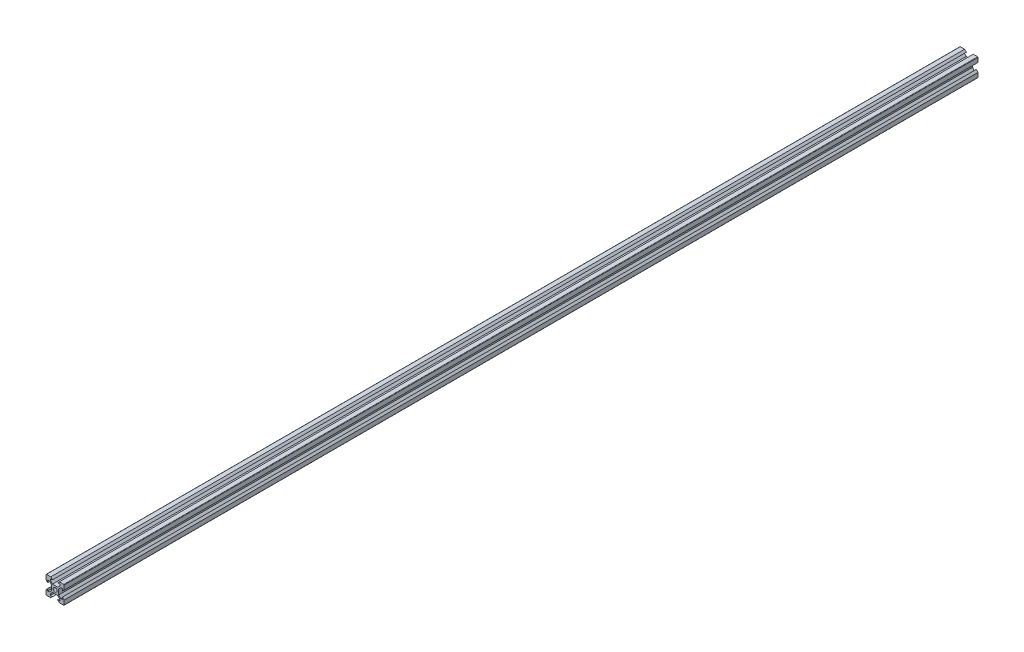
from build123d import *

# Parameters (mm, degrees)
SKETCH1_R           = 2.125
BOSS_EXTRUDE1_DEPTH = 1007.5


with BuildPart() as part:
    # Sketch1 → Boss-Extrude1 (new body)
    with BuildSketch(Plane.XY):
        with BuildLine():
            Line((8.1, 5.225), (8.1, 2.85))
            Line((8.1, 2.85), (10, 4.75))
            Line((10, 4.75), (10, 9.5))
            ThreePointArc((10, 9.5), (9.853553391, 9.853553391), (9.5, 10))
            Line((9.5, 10), (4.75, 10))
            Line((4.75, 10), (2.85, 8.1))
            Line((2.85, 8.1), (5.225, 8.1))
            Line((5.225, 8.1), (5.225, 6.325))
            Line((5.225, 6.325), (2.9, 4))
            Line((2.9, 4), (-2.9, 4))
            Line((-2.9, 4), (-5.225, 6.325))
            Line((-5.225, 6.325), (-5.225, 8.1))
            Line((-5.225, 8.1), (-2.85, 8.1))
            Line((-2.85, 8.1), (-4.75, 10))
            Line((-4.75, 10), (-9.5, 10))
            ThreePointArc((-9.5, 10), (-9.853553391, 9.853553391), (-10, 9.5))
            Line((-10, 9.5), (-10, 4.75))
            Line((-10, 4.75), (-8.1, 2.85))
            Line((-8.1, 2.85), (-8.1, 5.225))
            Line((-8.1, 5.225), (-6.325, 5.225))
            Line((-6.325, 5.225), (-4, 2.9))
            Line((-4, 2.9), (-4, -2.9))
            Line((-4, -2.9), (-6.325, -5.225))
            Line((-6.325, -5.225), (-8.1, -5.225))
            Line((-8.1, -5.225), (-8.1, -2.85))
            Line((-8.1, -2.85), (-10, -4.75))
            Line((-10, -4.75), (-10, -9.5))
            ThreePointArc((-10, -9.5), (-9.853553391, -9.853553391), (-9.5, -10))
            Line((-9.5, -10), (-4.75, -10))
            Line((-4.75, -10), (-2.85, -8.1))
            Line((-2.85, -8.1), (-5.225, -8.1))
            Line((-5.225, -8.1), (-5.225, -6.325))
            Line((-5.225, -6.325), (-2.9, -4))
            Line((-2.9, -4), (2.9, -4))
            Line((2.9, -4), (5.225, -6.325))
            Line((5.225, -6.325), (5.225, -8.1))
            Line((5.225, -8.1), (2.85, -8.1))
            Line((2.85, -8.1), (4.75, -10))
            Line((4.75, -10), (9.5, -10))
            ThreePointArc((9.5, -10), (9.853553391, -9.853553391), (10, -9.5))
            Line((10, -9.5), (10, -4.75))
            Line((10, -4.75), (8.1, -2.85))
            Line((8.1, -2.85), (8.1, -5.225))
            Line((8.1, -5.225), (6.325, -5.225))
            Line((6.325, -5.225), (4, -2.9))
            Line((4, -2.9), (4, 2.9))
            Line((4, 2.9), (6.325, 5.225))
            Line((6.325, 5.225), (8.1, 5.225))
        make_face()
        Circle(SKETCH1_R, mode=Mode.SUBTRACT)
    extrude(amount=BOSS_EXTRUDE1_DEPTH)


solid = part.part
